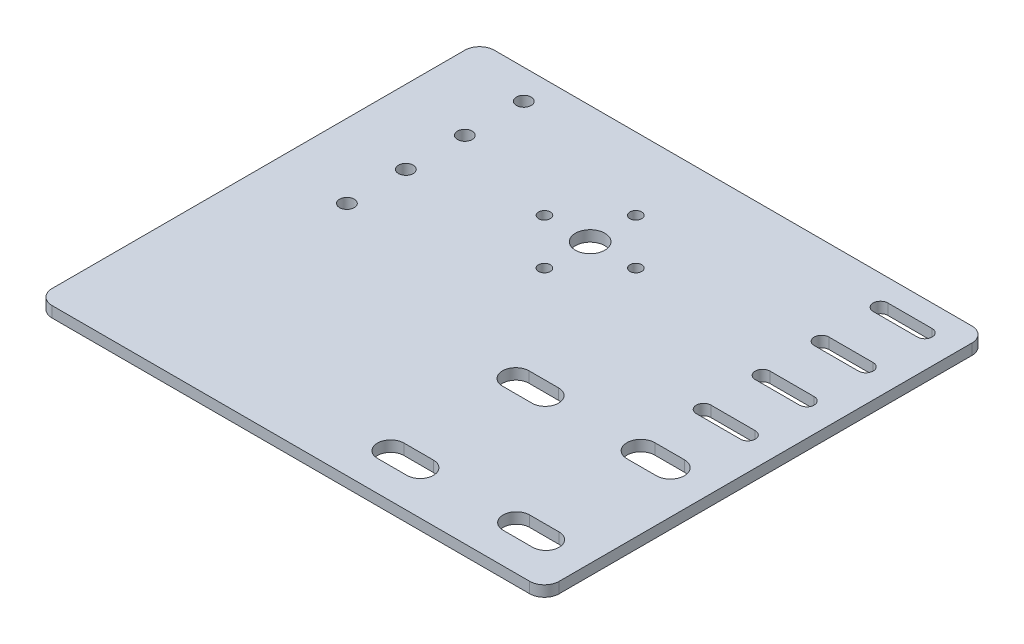
from build123d import *

# Parameters (mm, degrees)
SKETCH_2_W          = 62.5
SKETCH_2_H          = 3.676470588
EXTRUDE_1_DEPTH     = 40
SKETCH_4_R          = 2
SKETCH_4_R_2        = 5
SKETCH_4_R_3        = 2.5
CUT_EXTRUDE_1_DEPTH = 75.295130634
SKETCH_5_W          = 125
SKETCH_5_H          = 3.676470588
EXTRUDE_3_DEPTH     = 50
SKETCH_6_W          = 130
SKETCH_6_H          = 3.676470588
EXTRUDE_4_DEPTH     = 12
SKETCH_7_R          = 2.5
CUT_EXTRUDE_2_DEPTH = 117.892114516
SKETCH_8_W          = 130
SKETCH_8_H          = 3.676470588
EXTRUDE_5_DEPTH     = 20
CUT_EXTRUDE_4_DEPTH = 131.55177684
SKETCH_11_W         = 130
SKETCH_11_H         = 3.676470588
EXTRUDE_6_DEPTH     = 15
SKETCH_12_W         = 172
SKETCH_12_H         = 3.676470588
EXTRUDE_7_DEPTH     = 20
CUT_EXTRUDE_5_DEPTH = 146.064697415
FILLET_2_R          = 5


with BuildPart() as part:
    # 草图2 → 凸台-拉伸1 (new, symmetric)
    with BuildSketch(Plane.XY):
        with Locations((-31.25, 1.838235294)):
            Rectangle(SKETCH_2_W, SKETCH_2_H)
    extrude_1 = extrude(amount=EXTRUDE_1_DEPTH, both=True)

    # 镜向1: 凸台-拉伸1 across plane
    add(extrude_1.mirror(Plane(origin=(0, 0, 40), x_dir=(0, 0, 1), z_dir=(-1, 0, 0))))

    # 草图4 → 切除-拉伸1 (cut, through all)
    with BuildSketch(Plane(origin=(0, 3.676470588, 0), x_dir=(1, 0, 0), z_dir=(0, 1, 0))):
        with Locations(Location((0, 15.5, 0), (0, 0, 180))):
            Circle(SKETCH_4_R)
        with Locations(Location((15.5, 0, 0), (0, 0, 180))):
            Circle(SKETCH_4_R)
        with Locations(Location((0, -15.5, 0), (0, 0, 180))):
            Circle(SKETCH_4_R)
        with Locations(Location((-15.5, 0, 0), (0, 0, 180))):
            Circle(SKETCH_4_R)
        with Locations(Location((0, 0, 0), (0, 0, 180))):
            Circle(SKETCH_4_R_2)
        with Locations(Location((-52.5, 10, 0), (0, 0, 180))):
            Circle(SKETCH_4_R_3)
        with Locations(Location((-52.5, 30, 0), (0, 0, 180))):
            Circle(SKETCH_4_R_3)
        with Locations(Location((-52.5, -10, 0), (0, 0, 180))):
            Circle(SKETCH_4_R_3)
        with Locations(Location((-52.5, -30, 0), (0, 0, 180))):
            Circle(SKETCH_4_R_3)
    extrude(amount=-CUT_EXTRUDE_1_DEPTH, mode=Mode.SUBTRACT)

    # 草图5 → 凸台-拉伸3 (add)
    with BuildSketch(Plane.XY.offset(40)):
        with Locations((0, 1.838235294)):
            Rectangle(SKETCH_5_W, SKETCH_5_H)
    extrude(amount=EXTRUDE_3_DEPTH)

    # 草图6 → 凸台-拉伸4 (add)
    with BuildSketch(Plane(origin=(62.5, 0, 0), x_dir=(0, 0, -1), z_dir=(1, 0, 0))):
        with Locations((-25, 1.838235294)):
            Rectangle(SKETCH_6_W, SKETCH_6_H)
    extrude(amount=EXTRUDE_4_DEPTH)

    # 草图7 → 切除-拉伸2 (cut, through all)
    with BuildSketch(Plane(origin=(0, 3.676470588, 0), x_dir=(1, 0, 0), z_dir=(0, 1, 0))):
        with Locations(Location((68.5, 30, 0), (0, 0, 180))):
            Circle(SKETCH_7_R)
        with Locations(Location((68.5, 10, 0), (0, 0, 180))):
            Circle(SKETCH_7_R)
        with Locations(Location((68.5, -10, 0), (0, 0, 180))):
            Circle(SKETCH_7_R)
        with Locations(Location((68.5, -30, 0), (0, 0, 180))):
            Circle(SKETCH_7_R)
    extrude(amount=-CUT_EXTRUDE_2_DEPTH, mode=Mode.SUBTRACT)

    # 草图8 → 凸台-拉伸5 (add)
    with BuildSketch(Plane(origin=(74.5, 0, 0), x_dir=(0, 0, -1), z_dir=(1, 0, 0))):
        with Locations((-25, 1.838235294)):
            Rectangle(SKETCH_8_W, SKETCH_8_H)
    extrude(amount=EXTRUDE_5_DEPTH)

    # 草图10 → 切除-拉伸4 (cut, through all)
    with BuildSketch(Plane(origin=(0, 3.676470588, 0), x_dir=(1, 0, 0), z_dir=(0, 1, 0))):
        with BuildLine():
            Line((68.5, 32.5), (83.5, 32.5))
            ThreePointArc((83.5, 32.5), (86, 30), (83.5, 27.5))
            Line((83.5, 27.5), (68.5, 27.5))
            ThreePointArc((68.5, 27.5), (66, 30), (68.5, 32.5))
        make_face()
        with BuildLine():
            Line((68.5, 12.5), (83.5, 12.5))
            ThreePointArc((83.5, 12.5), (86, 10), (83.5, 7.5))
            Line((83.5, 7.5), (68.5, 7.5))
            ThreePointArc((68.5, 7.5), (66, 10), (68.5, 12.5))
        make_face()
        with BuildLine():
            Line((68.5, -7.5), (83.5, -7.5))
            ThreePointArc((83.5, -7.5), (86, -10), (83.5, -12.5))
            Line((83.5, -12.5), (68.5, -12.5))
            ThreePointArc((68.5, -12.5), (66, -10), (68.5, -7.5))
        make_face()
        with BuildLine():
            Line((68.5, -27.5), (83.5, -27.5))
            ThreePointArc((83.5, -27.5), (86, -30), (83.5, -32.5))
            Line((83.5, -32.5), (68.5, -32.5))
            ThreePointArc((68.5, -32.5), (66, -30), (68.5, -27.5))
        make_face()
    extrude(amount=-CUT_EXTRUDE_4_DEPTH, mode=Mode.SUBTRACT)

    # 草图11 → 凸台-拉伸6 (add)
    with BuildSketch(Plane.ZY.offset(62.5)):
        with Locations((25, 1.838235294)):
            Rectangle(SKETCH_11_W, SKETCH_11_H)
    extrude(amount=EXTRUDE_6_DEPTH)

    # 草图12 → 凸台-拉伸7 (add)
    with BuildSketch(Plane.XY.offset(90)):
        with Locations((8.5, 1.838235294)):
            Rectangle(SKETCH_12_W, SKETCH_12_H)
    extrude(amount=EXTRUDE_7_DEPTH)

    # 草图13 → 切除-拉伸5 (cut, through all)
    with BuildSketch(Plane(origin=(0, 3.676470588, 0), x_dir=(1, 0, 0), z_dir=(0, 1, 0))):
        with BuildLine():
            Line((80, -99.512851956), (70, -99.512851956))
            ThreePointArc((70, -99.512851956), (65.5, -95.012851956), (70, -90.512851956))
            Line((70, -90.512851956), (80, -90.512851956))
            ThreePointArc((80, -90.512851956), (84.5, -95.012851956), (80, -99.512851956))
        make_face()
        with BuildLine():
            Line((37.573593129, -99.713203436), (27.573593129, -99.713203436))
            ThreePointArc((27.573593129, -99.713203436), (23.073593129, -95.213203436), (27.573593129, -90.713203436))
            Line((27.573593129, -90.713203436), (37.573593129, -90.713203436))
            ThreePointArc((37.573593129, -90.713203436), (42.073593129, -95.213203436), (37.573593129, -99.713203436))
        make_face()
        with BuildLine():
            Line((37.573593129, -57.286796564), (27.573593129, -57.286796564))
            ThreePointArc((27.573593129, -57.286796564), (23.073593129, -52.786796564), (27.573593129, -48.286796564))
            Line((27.573593129, -48.286796564), (37.573593129, -48.286796564))
            ThreePointArc((37.573593129, -48.286796564), (42.073593129, -52.786796564), (37.573593129, -57.286796564))
        make_face()
        with BuildLine():
            Line((80, -57.520090719), (70, -57.520090719))
            ThreePointArc((70, -57.520090719), (65.266705846, -52.786796564), (70, -48.05350241))
            Line((70, -48.05350241), (80, -48.05350241))
            ThreePointArc((80, -48.05350241), (84.733294154, -52.786796564), (80, -57.520090719))
        make_face()
    extrude(amount=-CUT_EXTRUDE_5_DEPTH, mode=Mode.SUBTRACT)

    # 圆角2
    fillet_2_edges = [part.edges().sort_by_distance(p)[0] for p in [
        (94.5, 1.838235294, -40),
        (-77.5, 1.838235294, -40),
        (94.5, 1.838235294, 110),
        (-77.5, 1.838235294, 110),
    ]]
    fillet(fillet_2_edges, radius=FILLET_2_R)


solid = part.part
